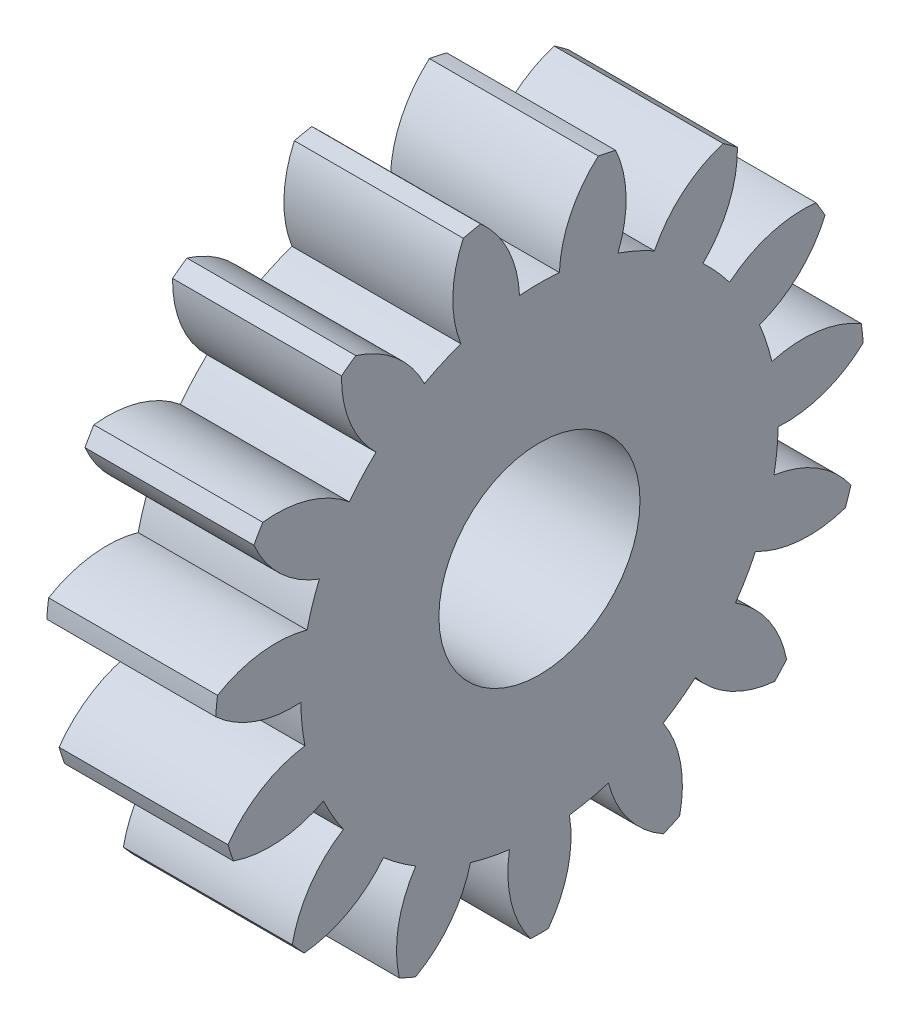
from build123d import *

# Parameters (mm, degrees)
BASPROSKE_W     = 8.4
BASPROSKE_H     = 16.15
TOOTHCUT_DEPTH  = 25.335262481
TEETHCUTS_COUNT = 15
TEETHCUTS_ANGLE = 336
BORSKE_R        = 5
BORE_DEPTH      = 50.0000508


with BuildPart() as part:
    # BasProSke → Base-Revolve (revolve)
    with BuildSketch(Plane(origin=(0, 0, 0), x_dir=(1, 0, 0), z_dir=(0, 1, 0)), mode=Mode.PRIVATE) as base_revolve_sk:
        with Locations((4.2, 8.075)):
            Rectangle(BASPROSKE_W, BASPROSKE_H)
    revolve(base_revolve_sk.sketch.rotate(Axis((-10, 0, 0), (1, 0, 0)), 180), axis=Axis((-10, 0, 0), (1, 0, 0)))

    # TooCutSke → ToothCut (cut, through all)
    with BuildSketch(Plane(origin=(0, 0, 0), x_dir=(0, 0, -1), z_dir=(1, 0, 0))):
        with BuildLine():
            ThreePointArc((0.992222723, 11.832471004), (0, 11.874), (-0.992222723, 11.832471004))
            ThreePointArc((-0.992222723, 11.832471004), (-1.550216444, 14.070532577), (-2.949450668, 15.904222896))
            ThreePointArc((-2.949450668, 15.904222896), (0, 16.1754), (2.949450668, 15.904222896))
            ThreePointArc((2.949450668, 15.904222896), (1.550216444, 14.070532577), (0.992222723, 11.832471004))
        make_face()
    toothcut = extrude(amount=TOOTHCUT_DEPTH, mode=Mode.SUBTRACT)

    # TeethCuts: ToothCut ×15 about axis
    teethcuts_axis = Axis((-10, 0, 0), (1, 0, 0))
    for i in range(1, TEETHCUTS_COUNT):
        add(toothcut.rotate(teethcuts_axis, i * TEETHCUTS_ANGLE / (TEETHCUTS_COUNT - 1)), mode=Mode.SUBTRACT)

    # BorSke → Bore (cut, symmetric)
    with BuildSketch(Plane(origin=(0, 0, 0), x_dir=(0, 0, -1), z_dir=(1, 0, 0))):
        with Locations(Location((0, 0, 0), (0, 0, 180))):
            Circle(BORSKE_R)
    extrude(amount=BORE_DEPTH, both=True, mode=Mode.SUBTRACT)


solid = part.part
